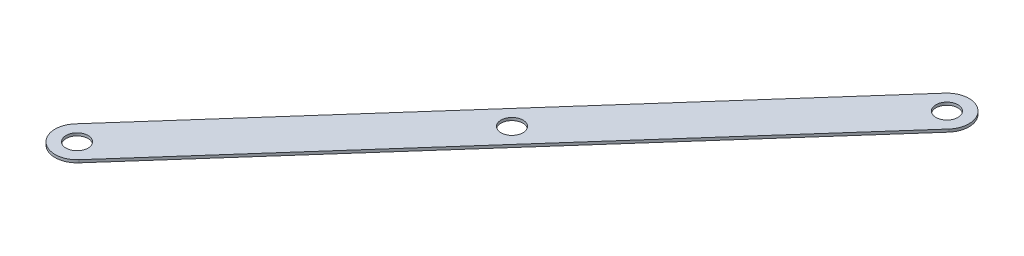
from build123d import *

# Parameters (mm, degrees)
SKETCH1_R           = 6.35
BOSS_EXTRUDE1_DEPTH = 1.5875


with BuildPart() as part:
    # Sketch1 → Boss-Extrude1 (new body)
    with BuildSketch(Plane(origin=(0, 0, 0), x_dir=(1, 0, 0), z_dir=(0, 1, 0))):
        with BuildLine():
            Line((-9.511548238, 8.415488704), (226.122135464, 274.738839361))
            ThreePointArc((226.122135464, 274.738839361), (244.049172405, 275.834898895), (245.145231939, 257.907861953))
            Line((245.145231939, 257.907861953), (9.511548238, -8.415488704))
            ThreePointArc((9.511548238, -8.415488704), (-8.415488704, -9.511548238), (-9.511548238, 8.415488704))
        make_face()
        with Locations(Location((117.816841851, 133.161675329, 0), (0, 0, 270))):
            Circle(SKETCH1_R, mode=Mode.SUBTRACT)
        with Locations(Location((235.633683702, 266.323350657, 0), (0, 0, 270))):
            Circle(SKETCH1_R, mode=Mode.SUBTRACT)
        with Locations(Location((0, 0, 0), (0, 0, 270))):
            Circle(SKETCH1_R, mode=Mode.SUBTRACT)
    extrude(amount=BOSS_EXTRUDE1_DEPTH)


solid = part.part
